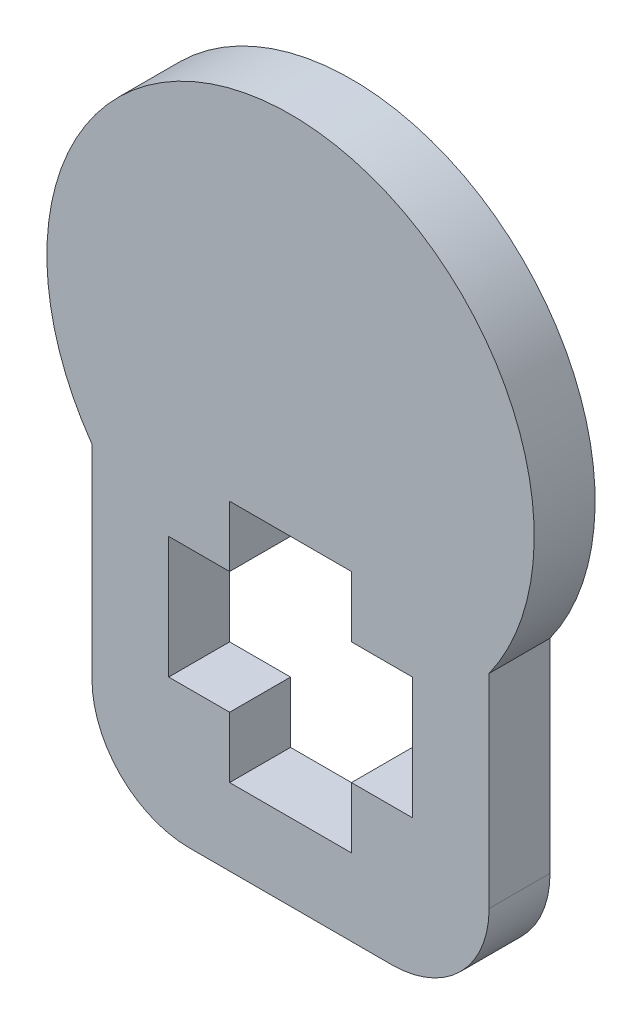
from build123d import *

# Parameters (mm, degrees)
BOSS_EXTRUDE1_DEPTH = 1.5875
FILLET1_R           = 2.54


with BuildPart() as part:
    # Sketch1 → Boss-Extrude1 (new body)
    with BuildSketch(Plane.XY):
        with BuildLine():
            Line((-5.175, 2.670071332), (-5.175, -5.175))
            Line((-5.175, -5.175), (5.175, -5.175))
            Line((5.175, -5.175), (5.175, 2.670071332))
            ThreePointArc((5.175, 2.670071332), (0, 12.7), (-5.175, 2.670071332))
        make_face()
        Polygon((-3.175, -1.5875), (-3.175, 1.5875), (-1.5875, 1.5875), (-1.5875, 3.175), (1.5875, 3.175), (1.5875, 1.5875), (3.175, 1.5875), (3.175, -1.5875), (1.5875, -1.5875), (1.5875, -3.175), (-1.5875, -3.175), (-1.5875, -1.5875), align=None, mode=Mode.SUBTRACT)
    extrude(amount=BOSS_EXTRUDE1_DEPTH)

    # Fillet1
    fillet1_edges = [part.edges().sort_by_distance(p)[0] for p in [
        (5.175, -5.175, 0.79375),
        (-5.175, -5.175, 0.79375),
    ]]
    fillet(fillet1_edges, radius=FILLET1_R)


solid = part.part
